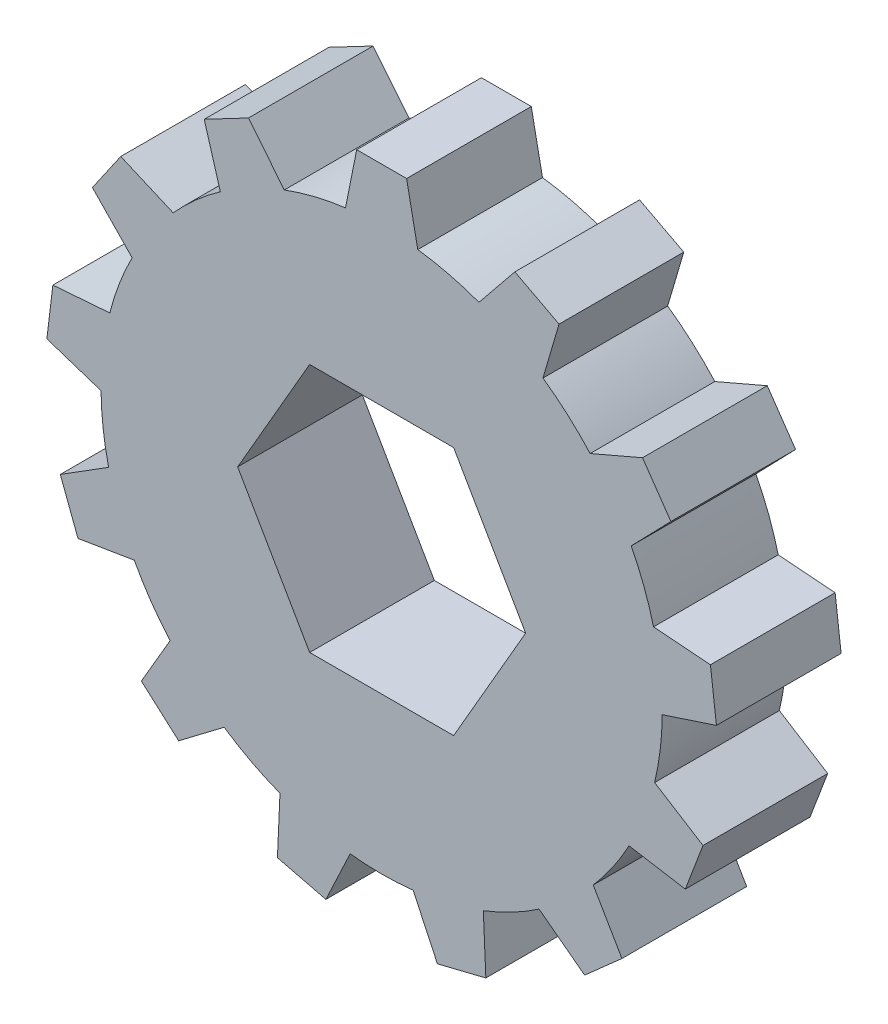
from build123d import *

# Parameters (mm, degrees)
SKETCH1_R           = 14.2875
BOSS_EXTRUDE1_DEPTH = 6.35
BOSS_EXTRUDE2_DEPTH = 6.35
CIRPATTERN1_COUNT   = 13


with BuildPart() as part:
    # Sketch1 → Boss-Extrude1 (new body)
    with BuildSketch(Plane.XY):
        Circle(SKETCH1_R)
        Polygon((7.332348419, 0), (3.666174209, 6.35), (-3.666174209, 6.35), (-7.332348419, 0), (-3.666174209, -6.35), (3.666174209, -6.35), align=None, mode=Mode.SUBTRACT)
    extrude(amount=BOSS_EXTRUDE1_DEPTH)

    # Sketch2 → Boss-Extrude2 (add)
    with BuildSketch(Plane.XY):
        Polygon((-1.27, 17.018), (1.27, 17.018), (1.905, 13.843), (-1.905, 13.843), align=None)
    boss_extrude2 = extrude(amount=BOSS_EXTRUDE2_DEPTH)

    # CirPattern1: Boss-Extrude2 ×13 about axis
    cirpattern1_axis = Axis((0, 0, 0), (0, 0, 1))
    for i in range(1, CIRPATTERN1_COUNT):
        add(boss_extrude2.rotate(cirpattern1_axis, i * 360 / CIRPATTERN1_COUNT))


solid = part.part
